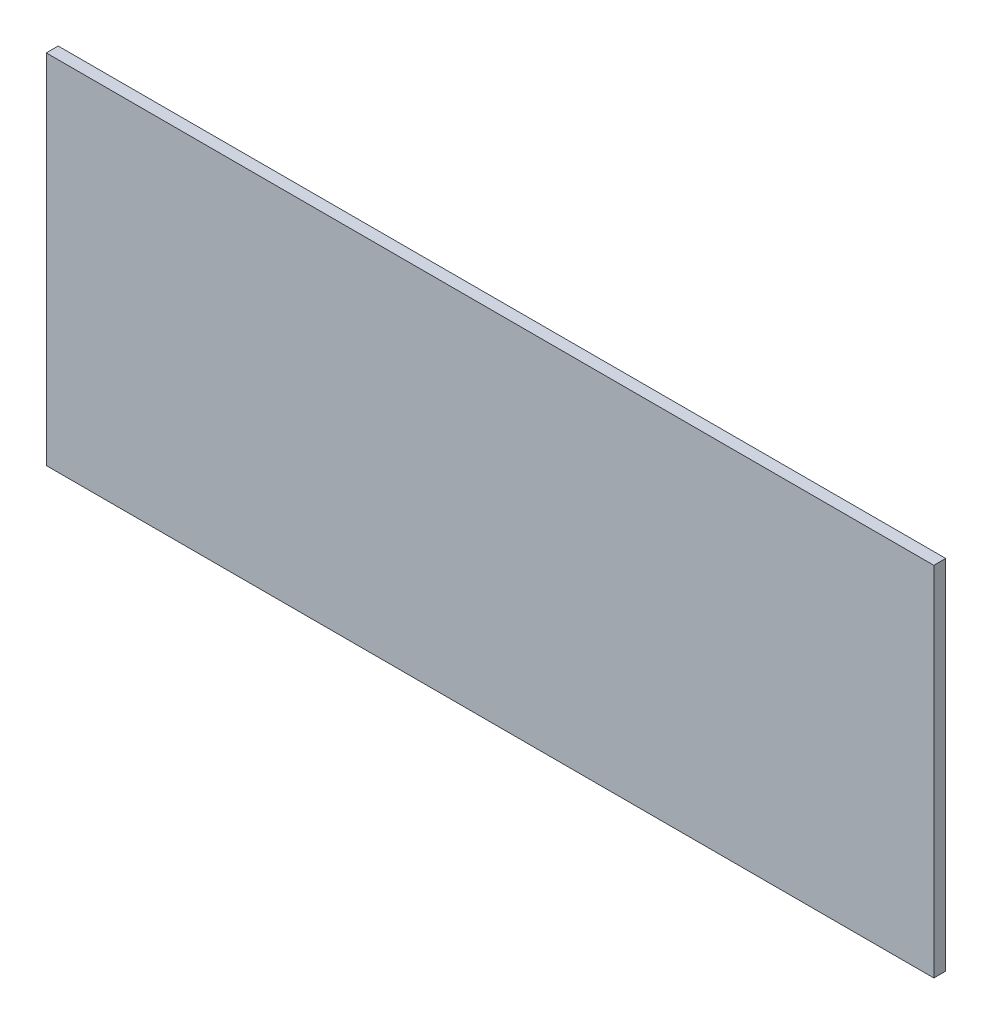
from build123d import *

# Parameters (mm, degrees)
SKETCH1_W           = 149
SKETCH1_H           = 60
BOSS_EXTRUDE1_DEPTH = 2


with BuildPart() as part:
    # Sketch1 → Boss-Extrude1 (new body)
    with BuildSketch(Plane.XY):
        Rectangle(SKETCH1_W, SKETCH1_H)
    extrude(amount=BOSS_EXTRUDE1_DEPTH)


solid = part.part
